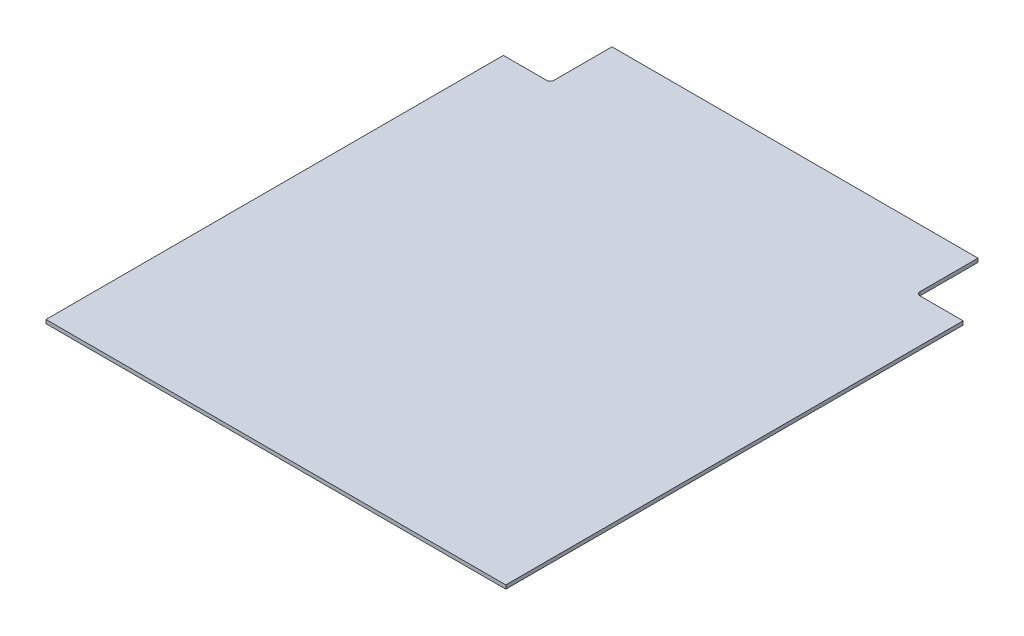
from build123d import *

# Parameters (mm, degrees)
SKETCH1_W           = 393.7
SKETCH1_H           = 444.5
BOSS_EXTRUDE1_DEPTH = 3.175
CUT_EXTRUDE1_DEPTH  = 10


with BuildPart() as part:
    # Sketch1 → Boss-Extrude1 (new body)
    with BuildSketch(Plane(origin=(0, 0, 0), x_dir=(1, 0, 0), z_dir=(0, 1, 0))):
        Rectangle(SKETCH1_W, SKETCH1_H)
    extrude(amount=BOSS_EXTRUDE1_DEPTH)

    # Sketch2 → Cut-Extrude1 (cut)
    with BuildSketch(Plane(origin=(0, 3.175, 0), x_dir=(1, 0, 0), z_dir=(0, 1, 0))):
        with BuildLine():
            Line((-196.85, 222.25), (-156.718, 222.25))
            Line((-156.718, 222.25), (-156.718, 172.593))
            ThreePointArc((-156.718, 172.593), (-157.64793597, 170.34793597), (-159.893, 169.418))
            Line((-159.893, 169.418), (-196.85, 169.418))
            Line((-196.85, 169.418), (-196.85, 222.25))
        make_face()
        with BuildLine():
            Line((196.85, 222.25), (156.718, 222.25))
            Line((156.718, 222.25), (156.718, 172.593))
            ThreePointArc((156.718, 172.593), (157.64793597, 170.34793597), (159.893, 169.418))
            Line((159.893, 169.418), (196.85, 169.418))
            Line((196.85, 169.418), (196.85, 222.25))
        make_face()
    extrude(amount=-CUT_EXTRUDE1_DEPTH, mode=Mode.SUBTRACT)


solid = part.part
